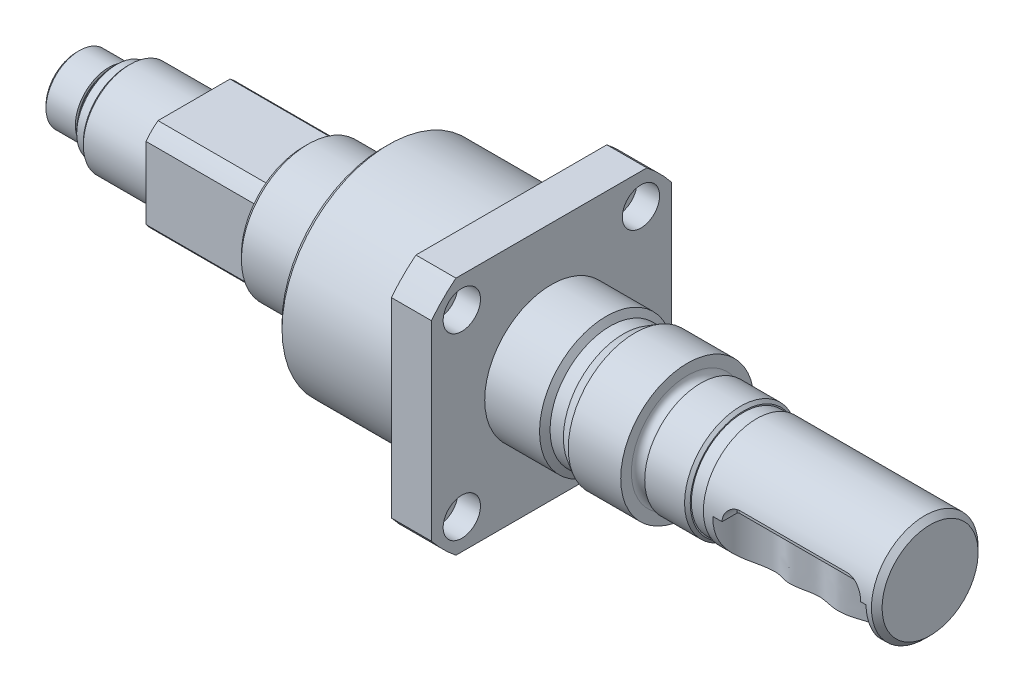
from build123d import *

# Parameters (mm, degrees)
BOSS_EXTRUDE2_DEPTH = 41
BOSS_EXTRUDE3_DEPTH = 15
SKETCH6_R           = 7
CUT_EXTRUDE1_DEPTH  = 8.5
SKETCH7_R           = 4.5
CUT_EXTRUDE3_DEPTH  = 182.053168986
CUT_EXTRUDE4_START  = 20
CUT_EXTRUDE4_DEPTH  = 6
FILLET1_R           = 0.5
SKETCH9_W           = 2
SKETCH9_H           = 2
CUT_EXTRUDE5_DEPTH  = 67


with BuildPart() as part:
    # Sketch1 → Revolve4 (revolve)
    with BuildSketch(Plane.XY, mode=Mode.PRIVATE) as revolve4_sk:
        with BuildLine():
            Line((0, 0), (0, 40))
            Line((0, 40), (-22, 40))
            Line((-22, 40), (-24, 38))
            Line((-24, 38), (-24, 25))
            ThreePointArc((-24, 25), (-26.5, 22.5), (-29, 25))
            Line((-29, 25), (-52.232233047, 25))
            Line((-52.232233047, 25), (-54, 23.232233047))
            Line((-54, 23.232233047), (-54, 18))
            Line((-54, 18), (-95, 18))
            Line((-95, 18), (-95, 17.5))
            Line((-95, 17.5), (-120, 17.5))
            Line((-120, 17.5), (-120, 15))
            Line((-120, 15), (-125, 15))
            Line((-125, 15), (-125, 11.5))
            Line((-125, 11.5), (-127, 11.5))
            Line((-127, 11.5), (-127, 12.5))
            Line((-127, 12.5), (-139, 12.5))
            Line((-139, 12.5), (-139, 0))
            Line((-139, 0), (0, 0))
        make_face()
        with BuildLine():
            Line((24, 40), (0, 40))
            Line((0, 40), (0, 0))
            Line((0, 0), (181, 0))
            Line((181, 0), (181, 18))
            Line((181, 18), (179, 20))
            Line((179, 20), (116, 20))
            Line((116, 20), (116, 19.5))
            Line((116, 19.5), (111, 19.5))
            Line((111, 19.5), (111, 19.939339828))
            Line((111, 19.939339828), (109.939339828, 21))
            Line((109.939339828, 21), (95, 21))
            ThreePointArc((95, 21), (92.5, 18.5), (90, 21))
            Line((90, 21), (90, 25))
            Line((90, 25), (70.330127019, 25))
            Line((70.330127019, 25), (66, 22.5))
            Line((66, 22.5), (61, 22.5))
            Line((61, 22.5), (59.556624327, 25))
            Line((59.556624327, 25), (39, 25))
            Line((39, 25), (39, 45))
            Line((39, 45), (24, 45))
            Line((24, 45), (24, 40))
        make_face()
    revolve(revolve4_sk.sketch.rotate(Axis((-674.916528026, 0, 0), (1, 0, 0)), 90), axis=Axis((-674.916528026, 0, 0), (1, 0, 0)))

    # Sketch2 → Cut-Revolve1 (revolve, cut)
    with BuildSketch(Plane(origin=(0, 0, 0), x_dir=(1, 0, 0), z_dir=(0, 1, 0)), mode=Mode.PRIVATE) as cut_revolve1_sk:
        Polygon((-139, 12.5), (-139, 11.5), (-138, 12.5), align=None)
        Polygon((-125, 15), (-124, 15), (-125, 14), align=None)
        Polygon((-120, 17.5), (-119, 17.5), (-120, 16.5), align=None)
    revolve(cut_revolve1_sk.sketch.rotate(Axis((-139, 0, 0), (-1, 0, 0)), 180), axis=Axis((-139, 0, 0), (-1, 0, 0)), mode=Mode.SUBTRACT)

    # Sketch4 → Boss-Extrude2 (add)
    with BuildSketch(Plane.ZY.offset(95)):
        with BuildLine():
            ThreePointArc((-18, -13.5), (-15.909902577, -15.909902577), (-13.5, -18))
            Line((-13.5, -18), (0, -18))
            ThreePointArc((0, -18), (-12.727922051, -12.727922072), (-18, -3.1e-08))
            Line((-18, -3.1e-08), (-18, -13.5))
        make_face()
        with BuildLine():
            ThreePointArc((18, 0), (12.727922061, -12.727922061), (0, -18))
            Line((0, -18), (13.5, -18))
            ThreePointArc((13.5, -18), (15.909902577, -15.909902577), (18, -13.5))
            Line((18, -13.5), (18, 0))
        make_face()
        with BuildLine():
            Line((-18, 13.5), (-18, -3.1e-08))
            ThreePointArc((-18, -3.1e-08), (-12.727922081, 12.727922041), (-2.6e-08, 18))
            Line((-2.6e-08, 18), (-13.5, 18))
            ThreePointArc((-13.5, 18), (-15.909902577, 15.909902577), (-18, 13.5))
        make_face()
        with BuildLine():
            ThreePointArc((-2.6e-08, 18), (12.727922052, 12.72792207), (18, 0))
            Line((18, 0), (18, 13.5))
            ThreePointArc((18, 13.5), (15.909902577, 15.909902577), (13.5, 18))
            Line((13.5, 18), (-2.6e-08, 18))
        make_face()
    extrude(amount=-BOSS_EXTRUDE2_DEPTH)

    # Sketch5 → Boss-Extrude3 (add)
    with BuildSketch(Plane.ZY.offset(-24)):
        with BuildLine():
            ThreePointArc((-45, -35.794552658), (-40.658639918, -40.658639918), (-35.794552658, -45))
            Line((-35.794552658, -45), (5.7e-08, -45))
            ThreePointArc((5.7e-08, -45), (-31.819805166, -31.819805141), (-45, 9.2e-08))
            Line((-45, 9.2e-08), (-45, -35.794552658))
        make_face()
        with BuildLine():
            ThreePointArc((45, 0), (31.819805173, -31.819805133), (5.7e-08, -45))
            Line((5.7e-08, -45), (35.794552658, -45))
            ThreePointArc((35.794552658, -45), (40.658639918, -40.658639918), (45, -35.794552658))
            Line((45, -35.794552658), (45, 0))
        make_face()
        with BuildLine():
            Line((-45, 35.794552658), (-45, 9.2e-08))
            ThreePointArc((-45, 9.2e-08), (-31.819805133, 31.819805173), (-3.5e-08, 45))
            Line((-3.5e-08, 45), (-35.794552658, 45))
            ThreePointArc((-35.794552658, 45), (-40.658639918, 40.658639918), (-45, 35.794552658))
        make_face()
        with BuildLine():
            ThreePointArc((-3.5e-08, 45), (31.819805141, 31.819805166), (45, 0))
            Line((45, 0), (45, 35.794552658))
            ThreePointArc((45, 35.794552658), (40.658639918, 40.658639918), (35.794552658, 45))
            Line((35.794552658, 45), (-3.5e-08, 45))
        make_face()
    extrude(amount=-BOSS_EXTRUDE3_DEPTH)

    # Sketch6 → Cut-Extrude1 (cut)
    with BuildSketch(Plane(origin=(39, 0, 0), x_dir=(0, 0, -1), z_dir=(1, 0, 0))):
        with Locations((33.587572106, -33.587572106)):
            Circle(SKETCH6_R)
        with Locations((-33.587572106, -33.587572106)):
            Circle(SKETCH6_R)
        with Locations((-33.587572106, 33.587572106)):
            Circle(SKETCH6_R)
        with Locations((33.587572106, 33.587572106)):
            Circle(SKETCH6_R)
    extrude(amount=-CUT_EXTRUDE1_DEPTH, mode=Mode.SUBTRACT)

    # Sketch7 → Cut-Extrude3 (cut, through all)
    with BuildSketch(Plane(origin=(30.5, 0, 0), x_dir=(0, 0, -1), z_dir=(1, 0, 0))):
        with Locations((-33.587572106, 33.587572106)):
            Circle(SKETCH7_R)
        with Locations((33.587572106, 33.587572106)):
            Circle(SKETCH7_R)
        with Locations((33.587572106, -33.587572106)):
            Circle(SKETCH7_R)
        with Locations((-33.587572106, -33.587572106)):
            Circle(SKETCH7_R)
    extrude(amount=-CUT_EXTRUDE3_DEPTH, mode=Mode.SUBTRACT)

    # Sketch8 → Cut-Extrude4 (cut)
    with BuildSketch(Plane.XY.offset(CUT_EXTRUDE4_START)):
        with BuildLine():
            Line((129, 6), (169, 6))
            ThreePointArc((169, 6), (175, 0), (169, -6))
            Line((169, -6), (129, -6))
            ThreePointArc((129, -6), (123, 0), (129, 6))
        make_face()
    extrude(amount=-CUT_EXTRUDE4_DEPTH, mode=Mode.SUBTRACT)

    # Fillet1
    fillet1_edges = [part.edges().sort_by_distance(p)[0] for p in [
        (123, 0, 14),
        (149, 6, 14),
        (175, 0, 14),
        (149, -6, 14),
    ]]
    fillet(fillet1_edges, radius=FILLET1_R)

    # Sketch9 → Cut-Revolve4 (revolve, cut)
    with BuildSketch(Plane(origin=(0, 0, 0), x_dir=(1, 0, 0), z_dir=(0, 1, 0))):
        with Locations((23, 39.805580606)):
            Rectangle(SKETCH9_W, SKETCH9_H)
    revolve(axis=Axis((0, 0, 0), (1, 0, 0)), mode=Mode.SUBTRACT)

    # Sketch10 → Cut-Extrude5 (cut)
    with BuildSketch(Plane(origin=(0, 0, 0), x_dir=(1, 0, 0), z_dir=(0, 1, 0))):
        with BuildLine():
            add(Edge.make_bspline(
                [(119.5, -20), (119.4343237, -17.368697319), (121.978363223, -10.659580725), (131.268578529, -6.279841391), (138.956198371, -11.950868732), (146.951705328, -4.997334987), (157.466576854, -13.168599305), (169.678696183, 1.734816973), (192.684384389, -42.378861196), (119.947652719, -37.935081581), (119.5, -20)],
                knots=[0, 0, 0, 0, 0.063996657, 0.145816351, 0.191701863, 0.254000923, 0.337932091, 0.426998628, 0.563795803, 1, 1, 1, 1], degree=3))
        make_face()
    extrude(amount=-CUT_EXTRUDE5_DEPTH, mode=Mode.SUBTRACT)


solid = part.part
